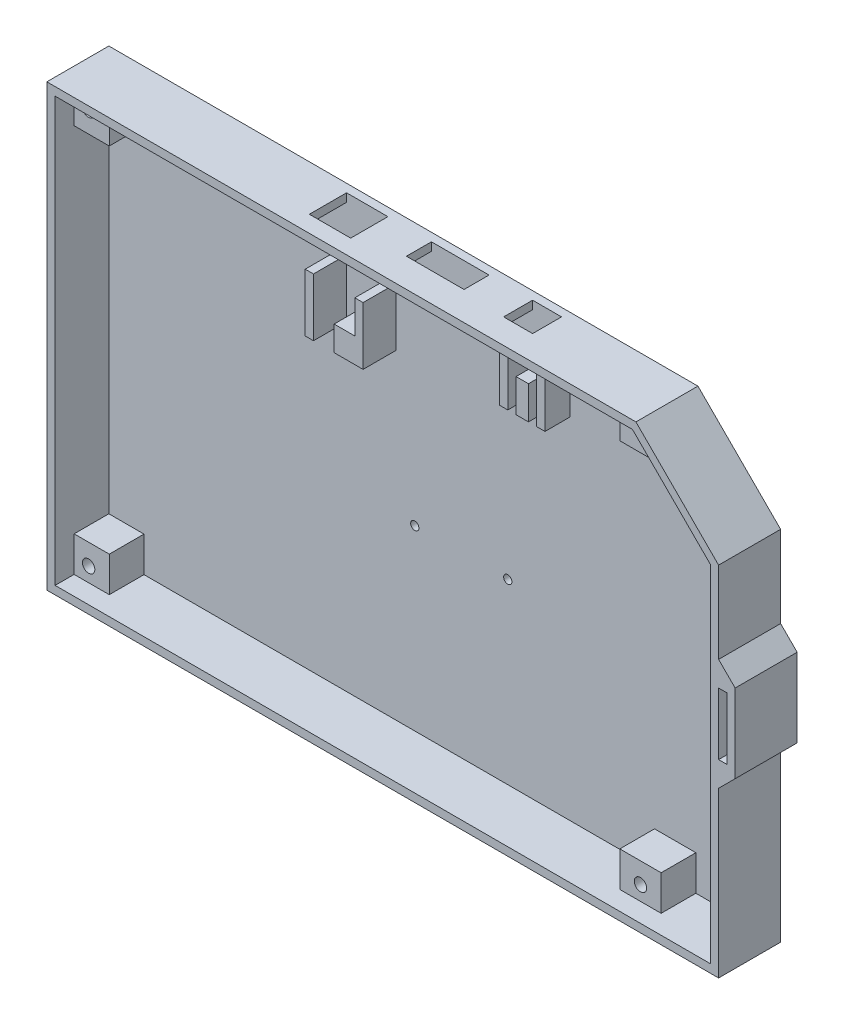
from build123d import *

# Parameters (mm, degrees)
SKETCH1_R           = 1
BOSS_EXTRUDE1_DEPTH = 2
SKETCH3_R           = 1.5
SKETCH3_W           = 10
SKETCH3_H           = 10
BOSS_EXTRUDE2_DEPTH = 8.4
SKETCH5_W           = 10.532166359
SKETCH5_H           = 2
BOSS_EXTRUDE3_DEPTH = 13
SKETCH6_W           = 10
SKETCH6_H           = 4
SKETCH6_W_2         = 13.935667282
SKETCH6_H_2         = 6.95
SKETCH6_W_3         = 7
SKETCH6_H_3         = 6
BOSS_EXTRUDE4_DEPTH = 2
SKETCH7_W           = 3
SKETCH7_H           = 8
SKETCH7_W_2         = 2
SKETCH7_H_2         = 12
BOSS_EXTRUDE5_DEPTH = 6
SKETCH8_W           = 2
SKETCH8_H           = 14
BOSS_EXTRUDE6_DEPTH = 8
BOSS_EXTRUDE7_DEPTH = 15


with BuildPart() as part:
    # Sketch1 → Boss-Extrude1 (new body)
    with BuildSketch(Plane.XY):
        Polygon((90.25, -53.25), (-72.25, -53.25), (-72.25, 53.25), (70.25, 53.25), (90.25, 33.25), align=None)
        with Locations((3.75, -8.25)):
            Circle(SKETCH1_R, mode=Mode.SUBTRACT)
        with Locations((26.25, -8.25)):
            Circle(SKETCH1_R, mode=Mode.SUBTRACT)
        with Locations((26.25, 48.75)):
            Circle(SKETCH1_R, mode=Mode.SUBTRACT)
        with Locations((3.75, 48.75)):
            Circle(SKETCH1_R, mode=Mode.SUBTRACT)
    extrude(amount=-BOSS_EXTRUDE1_DEPTH)

    # Sketch3 → Boss-Extrude2 (add)
    # profile 1 of 4: a face of its own
    with BuildSketch(Plane.XY):
        Polygon((61.75, 52.75), (70.75, 52.75), (71.75, 51.75), (71.75, 42.75), (61.75, 42.75), align=None)
        with Locations((66.75, 47.75)):
            Circle(SKETCH3_R, mode=Mode.SUBTRACT)
    # profile 2 of 4: a face of its own
    with BuildSketch(Plane.XY):
        with Locations((66.75, -47.75)):
            Rectangle(SKETCH3_W, SKETCH3_H)
        with Locations((66.75, -47.75)):
            Circle(SKETCH3_R, mode=Mode.SUBTRACT)
    # profile 3 of 4: a face of its own
    with BuildSketch(Plane.XY):
        with Locations((-66.75, 47.75)):
            Rectangle(SKETCH3_W, SKETCH3_H)
        with Locations((-66.75, 47.75)):
            Circle(SKETCH3_R, mode=Mode.SUBTRACT)
    # profile 4 of 4: a face of its own
    with BuildSketch(Plane.XY):
        with Locations((-66.75, -47.75)):
            Rectangle(SKETCH3_W, SKETCH3_H)
        with Locations((-66.75, -47.75)):
            Circle(SKETCH3_R, mode=Mode.SUBTRACT)
    extrude(amount=BOSS_EXTRUDE2_DEPTH)

    # Sketch5 → Boss-Extrude3 (add)
    with BuildSketch(Plane.XY):
        Polygon((90.25, 33.25), (90.25, -53.25), (-72.25, -53.25), (-72.25, 53.25), (-12.75, 53.25), (-12.75, 51.25), (-70.25, 51.25), (-70.25, -51.25), (88.25, -51.25), (88.25, 32.421572875), (69.421572875, 51.25), (39.25, 51.25), (39.25, 53.25), (70.25, 53.25), align=None)
        with Locations((2.51608318, 52.25)):
            Rectangle(SKETCH5_W, SKETCH5_H)
        with Locations((26.98391682, 52.25)):
            Rectangle(SKETCH5_W, SKETCH5_H)
    extrude(amount=BOSS_EXTRUDE3_DEPTH)

    # Sketch6 → Boss-Extrude4 (add)
    with BuildSketch(Plane(origin=(0, 53.25, 0), x_dir=(1, 0, 0), z_dir=(0, 1, 0))):
        with Locations((-7.75, -11)):
            Rectangle(SKETCH6_W, SKETCH6_H)
        with Locations((14.75, -9.525)):
            Rectangle(SKETCH6_W_2, SKETCH6_H_2)
        with Locations((35.75, -10)):
            Rectangle(SKETCH6_W_3, SKETCH6_H_3)
    extrude(amount=-BOSS_EXTRUDE4_DEPTH)

    # Sketch7 → Boss-Extrude5 (add)
    with BuildSketch(Plane.XY):
        with Locations((35.75, 37.25)):
            Rectangle(SKETCH7_W, SKETCH7_H)
        with Locations((31.25, 39.25)):
            Rectangle(SKETCH7_W_2, SKETCH7_H_2)
        with Locations((40.25, 39.25)):
            Rectangle(SKETCH7_W_2, SKETCH7_H_2)
    extrude(amount=BOSS_EXTRUDE5_DEPTH)

    # Sketch8 → Boss-Extrude6 (add)
    with BuildSketch(Plane.XY):
        with Locations((-13.75, 33.25)):
            Rectangle(SKETCH8_W, SKETCH8_H)
        Polygon((-7.75, 26.25), (-7.75, 32.25), (-3.75, 32.25), (-2.75, 32.25), (-2.75, 40.25), (-0.75, 40.25), (-0.75, 26.25), (-2.75, 26.25), align=None)
    extrude(amount=BOSS_EXTRUDE6_DEPTH)

    # Sketch9 → Boss-Extrude7 (add)
    with BuildSketch(Plane(origin=(0, 0, -2), x_dir=(-1, 0, 0), z_dir=(0, 0, -1))):
        Polygon((-92.25, 7.5), (-90.25, 7.5), (-90.25, 9.5), (-90.25, 13.5), (-94.25, 9.5), (-94.25, -9.5), (-90.25, -13.5), (-90.25, -9.5), (-90.25, -7.5), (-92.25, -7.5), align=None)
    extrude(amount=-BOSS_EXTRUDE7_DEPTH)


solid = part.part
